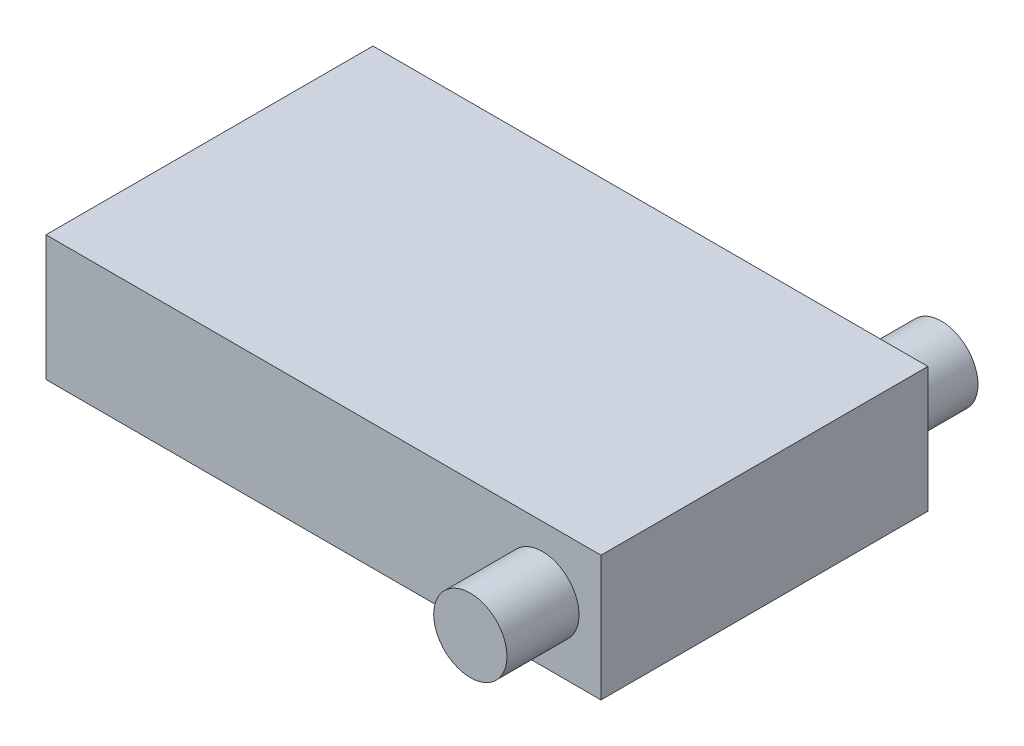
from build123d import *

# Parameters (mm, degrees)
SKETCH1_W           = 47.36
SKETCH1_H           = 27.9
BOSS_EXTRUDE1_DEPTH = 5.35
SKETCH2_R           = 3.125
BOSS_EXTRUDE2_DEPTH = 6.15
SKETCH3_W           = 11.2
SKETCH3_H           = 5
CUT_EXTRUDE1_DEPTH  = 1
SKETCH5_W           = 8.9
SKETCH5_H           = 3.2
CUT_EXTRUDE2_DEPTH  = 1


with BuildPart() as part:
    # Sketch1 → Boss-Extrude1 (new, symmetric)
    with BuildSketch(Plane(origin=(0, 0, 0), x_dir=(1, 0, 0), z_dir=(0, 1, 0))):
        Rectangle(SKETCH1_W, SKETCH1_H)
    extrude(amount=BOSS_EXTRUDE1_DEPTH, both=True)

    # Sketch2 → Boss-Extrude2 (add)
    with BuildSketch(Plane(origin=(9.73, 0, -13.95), x_dir=(1, 0, 0), z_dir=(0, 0, 1))):
        with Locations((8.95, 0)):
            Circle(SKETCH2_R)
    boss_extrude2 = extrude(amount=-BOSS_EXTRUDE2_DEPTH)

    # Lustro1: Boss-Extrude2 across plane
    add(boss_extrude2.mirror(Plane.XY))

    # Sketch3 → Cut-Extrude1 (cut)
    with BuildSketch(Plane.ZY.offset(23.68)):
        with Locations((-4.65, -1.55)):
            Rectangle(SKETCH3_W, SKETCH3_H)
    extrude(amount=-CUT_EXTRUDE1_DEPTH, mode=Mode.SUBTRACT)

    # Sketch5 → Cut-Extrude2 (cut)
    with BuildSketch(Plane.ZY.offset(23.68)):
        with Locations((5.4, -0.65)):
            Rectangle(SKETCH5_W, SKETCH5_H)
    extrude(amount=-CUT_EXTRUDE2_DEPTH, mode=Mode.SUBTRACT)


solid = part.part
